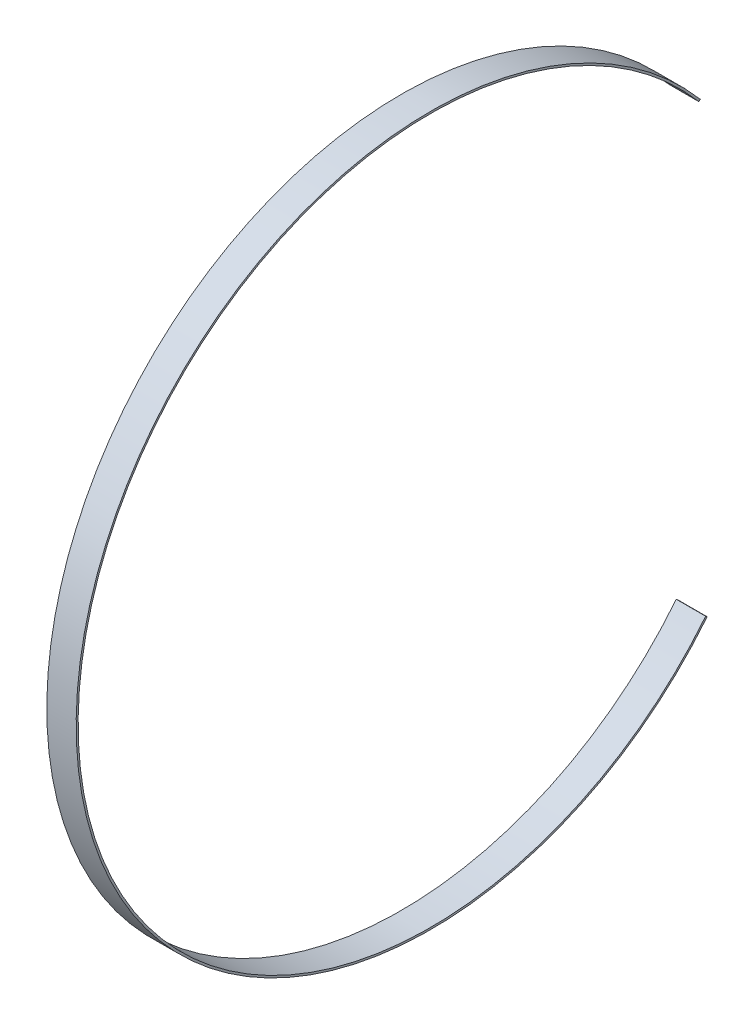
from build123d import *

# Parameters (mm, degrees)
EXTRUDE_THIN1_DEPTH = 38.1


with BuildPart() as part:
    # Sketch1 → Extrude-Thin1 (new body)
    with BuildSketch(Plane(origin=(0, 0, 0), x_dir=(0, 0, -1), z_dir=(1, 0, 0))):
        with BuildLine():
            ThreePointArc((347.934302391, 296.603373581), (-457.147457481, -6.93124222), (356.766467642, -285.918742943))
            Line((356.766467642, -285.918742943), (358.748503573, -287.507180404))
            ThreePointArc((358.748503573, -287.507180404), (-459.687165578, -6.969749122), (349.867270738, 298.251170101))
            Line((349.867270738, 298.251170101), (347.934302391, 296.603373581))
        make_face()
    extrude(amount=EXTRUDE_THIN1_DEPTH)


solid = part.part
